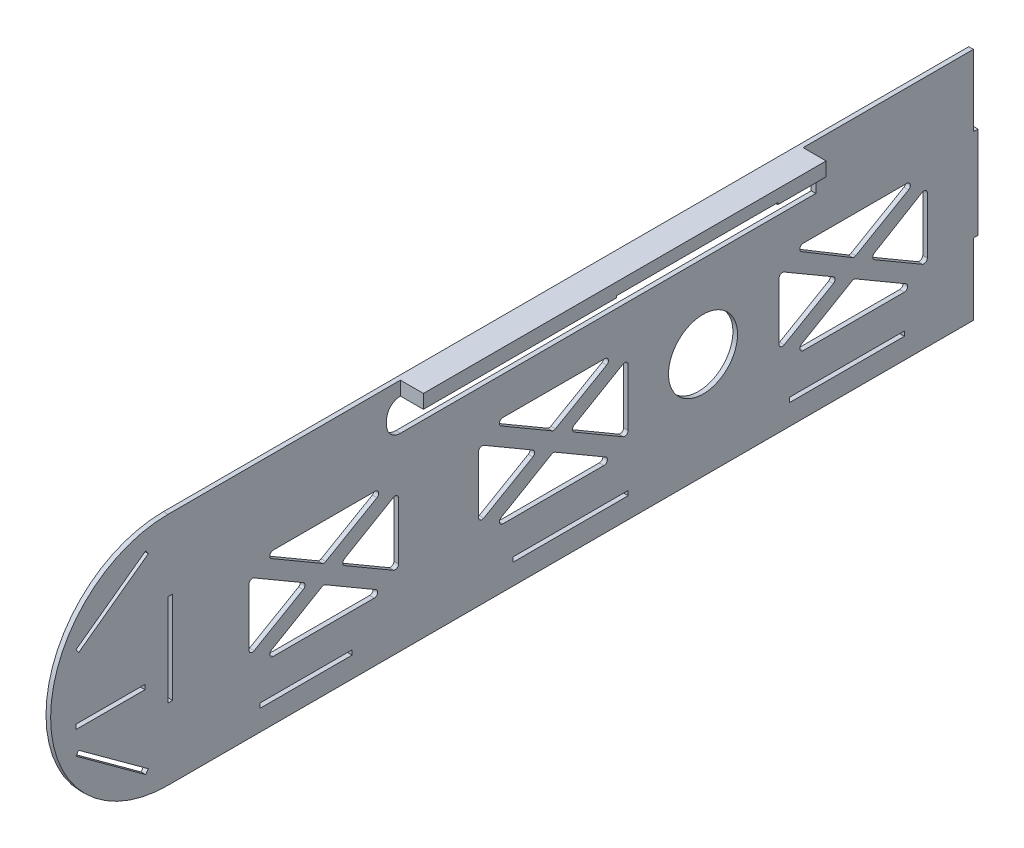
from build123d import *

# Parameters (mm, degrees)
SKETCH_1_W      = 2
SKETCH_1_H      = 40
SKETCH_1_W_2    = 40
SKETCH_1_H_2    = 2
SKETCH_1_W_3    = 50
SKETCH_1_R      = 15
SKETCH_1_W_4    = 30
EXTRUDE_3_DEPTH = 2
EXTRUDE_4_DEPTH = 12


with BuildPart() as part:
    # 草图1 → 凸台-拉伸3 (new body)
    with BuildSketch(Plane(origin=(0, 0, 0), x_dir=(0, 0, -1), z_dir=(1, 0, 0))):
        with BuildLine():
            ThreePointArc((0, 51), (-51, 0), (0, -51))
            Line((0, -51), (350, -51))
            Line((350, -51), (350, -20))
            Line((350, -20), (352, -20))
            Line((352, -20), (352, 20))
            Line((352, 20), (350, 20))
            Line((350, 20), (350, 51))
            Line((350, 51), (0, 51))
        make_face()
        with Locations((1, 0)):
            Rectangle(SKETCH_1_W, SKETCH_1_H, mode=Mode.SUBTRACT)
        with Locations((60, -41)):
            Rectangle(SKETCH_1_W_2, SKETCH_1_H_2, mode=Mode.SUBTRACT)
        with BuildLine():
            Line((35.191745563, -17.73919947), (35.191745563, 7.047932671))
            ThreePointArc((35.191745563, 7.047932671), (35.944654473, 8.3486459), (37.447552101, 8.343601023))
            Line((37.447552101, 8.343601023), (58.776761956, -4.098438059))
            ThreePointArc((58.776761956, -4.098438059), (59.520953252, -5.396654882), (58.772354967, -6.69233548))
            Line((58.772354967, -6.69233548), (37.443145112, -19.03742854))
            ThreePointArc((37.443145112, -19.03742854), (35.942445664, -19.038641528), (35.191745563, -17.73919947))
        make_face(mode=Mode.SUBTRACT)
        with BuildLine():
            Line((89.643364708, -25.34051183), (45.740126418, -25.34051183))
            ThreePointArc((45.740126418, -25.34051183), (44.292110098, -24.231981799), (44.98431988, -22.544843479))
            Line((44.98431988, -22.544843479), (66.935939025, -9.739732311))
            ThreePointArc((66.935939025, -9.739732311), (67.691745563, -9.535400662), (68.447552101, -9.739732311))
            Line((68.447552101, -9.739732311), (90.399171246, -22.544843479))
            ThreePointArc((90.399171246, -22.544843479), (91.091381028, -24.231981799), (89.643364708, -25.34051183))
        make_face(mode=Mode.SUBTRACT)
        with BuildLine():
            ThreePointArc((97.935939025, 8.343601023), (99.438836653, 8.3486459), (100.191745563, 7.047932671))
            Line((100.191745563, 7.047932671), (100.191745563, -17.728956331))
            ThreePointArc((100.191745563, -17.728956331), (99.438836653, -19.02966956), (97.935939025, -19.024624683))
            Line((97.935939025, -19.024624683), (76.698605594, -6.636180181))
            ThreePointArc((76.698605594, -6.636180181), (75.954412132, -5.34051183), (76.698605594, -4.044843479))
            Line((76.698605594, -4.044843479), (97.935939025, 8.343601023))
        make_face(mode=Mode.SUBTRACT)
        with BuildLine():
            Line((135, -17.73919947), (135, 7.047932671))
            ThreePointArc((135, 7.047932671), (135.75290891, 8.3486459), (137.255806538, 8.343601023))
            Line((137.255806538, 8.343601023), (158.585016393, -4.098438059))
            ThreePointArc((158.585016393, -4.098438059), (159.329207689, -5.396654882), (158.580609404, -6.69233548))
            Line((158.580609404, -6.69233548), (137.25139955, -19.03742854))
            ThreePointArc((137.25139955, -19.03742854), (135.750700102, -19.038641528), (135, -17.73919947))
        make_face(mode=Mode.SUBTRACT)
        with Locations((175, -41)):
            Rectangle(SKETCH_1_W_3, SKETCH_1_H_2, mode=Mode.SUBTRACT)
        with Locations((295, -41)):
            Rectangle(SKETCH_1_W_3, SKETCH_1_H_2, mode=Mode.SUBTRACT)
        with BuildLine():
            Line((189.451619145, -25.34051183), (145.548380855, -25.34051183))
            ThreePointArc((145.548380855, -25.34051183), (144.100364535, -24.231981799), (144.792574317, -22.544843479))
            Line((144.792574317, -22.544843479), (166.744193462, -9.739732311))
            ThreePointArc((166.744193462, -9.739732311), (167.5, -9.535400662), (168.255806538, -9.739732311))
            Line((168.255806538, -9.739732311), (190.207425683, -22.544843479))
            ThreePointArc((190.207425683, -22.544843479), (190.899635465, -24.231981799), (189.451619145, -25.34051183))
        make_face(mode=Mode.SUBTRACT)
        with BuildLine():
            ThreePointArc((197.744193462, 8.684112853), (199.24709109, 8.68915773), (200, 7.388444501))
            Line((200, 7.388444501), (200, -17.388444501))
            ThreePointArc((200, -17.388444501), (199.24709109, -18.68915773), (197.744193462, -18.684112853))
            Line((197.744193462, -18.684112853), (176.506860031, -6.295668351))
            ThreePointArc((176.506860031, -6.295668351), (175.762666569, -5), (176.506860031, -3.704331649))
            Line((176.506860031, -3.704331649), (197.744193462, 8.684112853))
        make_face(mode=Mode.SUBTRACT)
        with Locations((232.5, -5)):
            Circle(SKETCH_1_R, mode=Mode.SUBTRACT)
        with BuildLine():
            Line((319.974166797, -25.394327939), (276.070928507, -25.394327939))
            ThreePointArc((276.070928507, -25.394327939), (274.622912187, -24.285797907), (275.315121969, -22.598659587))
            Line((275.315121969, -22.598659587), (297.266741114, -9.793548419))
            ThreePointArc((297.266741114, -9.793548419), (298.022547652, -9.589216771), (298.778354191, -9.793548419))
            Line((298.778354191, -9.793548419), (320.729973336, -22.598659587))
            ThreePointArc((320.729973336, -22.598659587), (321.422183118, -24.285797907), (319.974166797, -25.394327939))
        make_face(mode=Mode.SUBTRACT)
        with BuildLine():
            Line((265.522547652, -17.793015579), (265.522547652, 6.994116563))
            ThreePointArc((265.522547652, 6.994116563), (266.275456563, 8.294829792), (267.778354191, 8.289784914))
            Line((267.778354191, 8.289784914), (289.107564045, -4.152254168))
            ThreePointArc((289.107564045, -4.152254168), (289.851755342, -5.45047099), (289.103157056, -6.746151588))
            Line((289.103157056, -6.746151588), (267.773947202, -19.091244648))
            ThreePointArc((267.773947202, -19.091244648), (266.273247754, -19.092457637), (265.522547652, -17.793015579))
        make_face(mode=Mode.SUBTRACT)
        with BuildLine():
            ThreePointArc((327.730104505, 8.28146303), (329.239985391, 8.298885363), (330, 6.994116563))
            Line((330, 6.994116563), (330, -17.477952976))
            ThreePointArc((330, -17.477952976), (329.24709109, -18.778666205), (327.744193462, -18.773621327))
            Line((327.744193462, -18.773621327), (307.029407683, -6.68999629))
            ThreePointArc((307.029407683, -6.68999629), (306.285236534, -5.40250951), (307.015318726, -4.106981472))
            Line((307.015318726, -4.106981472), (327.730104505, 8.28146303))
        make_face(mode=Mode.SUBTRACT)
        with BuildLine():
            ThreePointArc((44.98431988, 11.863819819), (44.292110098, 13.550958139), (45.740126418, 14.65948817))
            Line((45.740126418, 14.65948817), (90.076891362, 14.65948817))
            ThreePointArc((90.076891362, 14.65948817), (91.525570692, 13.548497422), (90.828290911, 11.861259101))
            Line((90.828290911, 11.861259101), (68.573204722, -1.019720173))
            ThreePointArc((68.573204722, -1.019720173), (67.819256701, -1.221488939), (67.065998635, -1.017159455))
            Line((67.065998635, -1.017159455), (44.98431988, 11.863819819))
        make_face(mode=Mode.SUBTRACT)
        with BuildLine():
            ThreePointArc((144.792574317, 11.863819819), (144.100364535, 13.550958139), (145.548380855, 14.65948817))
            Line((145.548380855, 14.65948817), (189.885145799, 14.65948817))
            ThreePointArc((189.885145799, 14.65948817), (191.333825129, 13.548497422), (190.636545348, 11.861259101))
            Line((190.636545348, 11.861259101), (168.381459159, -1.019720173))
            ThreePointArc((168.381459159, -1.019720173), (167.627511138, -1.221488939), (166.874253072, -1.017159455))
            Line((166.874253072, -1.017159455), (144.792574317, 11.863819819))
        make_face(mode=Mode.SUBTRACT)
        with BuildLine():
            ThreePointArc((275.298059327, 12.21443661), (274.625531488, 13.901032988), (276.070928507, 15))
            Line((276.070928507, 15), (321.088992758, 15))
            ThreePointArc((321.088992758, 15), (322.537672089, 13.889009252), (321.840392308, 12.20177093))
            Line((321.840392308, 12.20177093), (298.904006812, -1.073536282))
            ThreePointArc((298.904006812, -1.073536282), (298.140143671, -1.275255431), (297.379738082, -1.060870603))
            Line((297.379738082, -1.060870603), (275.298059327, 12.21443661))
        make_face(mode=Mode.SUBTRACT)
        with BuildLine():
            Line((95, 37), (95, 39))
            ThreePointArc((95, 39), (96.757359313, 43.242640687), (101, 45))
            Line((101, 45), (185, 45))
            Line((185, 45), (185, 45.8))
            Line((185, 45.8), (255, 45.8))
            Line((255, 45.8), (255, 45))
            Line((255, 45), (275.5, 45))
            ThreePointArc((275.5, 45), (279.742640687, 43.242640687), (281.5, 39))
            Line((281.5, 39), (281.5, 31))
            Line((281.5, 31), (101, 31))
            ThreePointArc((101, 31), (96.757359313, 32.757359313), (95, 37))
        make_face(mode=Mode.SUBTRACT)
        Polygon((-40, 20), (-9.698170842, 42.091834457), (-8.519939671, 40.475736902), (-38.821768829, 18.383902445), align=None, mode=Mode.SUBTRACT)
        with Locations((-25, -9)):
            Rectangle(SKETCH_1_W_4, SKETCH_1_H_2, mode=Mode.SUBTRACT)
        Polygon((-40, -20), (-38.821768829, -18.383902445), (-8.519939671, -40.475736902), (-9.698170842, -42.091834457), align=None, mode=Mode.SUBTRACT)
    extrude(amount=EXTRUDE_3_DEPTH)

    # 草图2 → 凸台-拉伸4 (add)
    with BuildSketch(Plane(origin=(0, 0, 0), x_dir=(0, 0, -1), z_dir=(1, 0, 0))):
        Polygon((101, 51), (101, 45), (185, 45), (185, 45.8), (255, 45.8), (255, 45), (276, 45), (276, 51), align=None)
    extrude(amount=EXTRUDE_4_DEPTH)


solid = part.part
